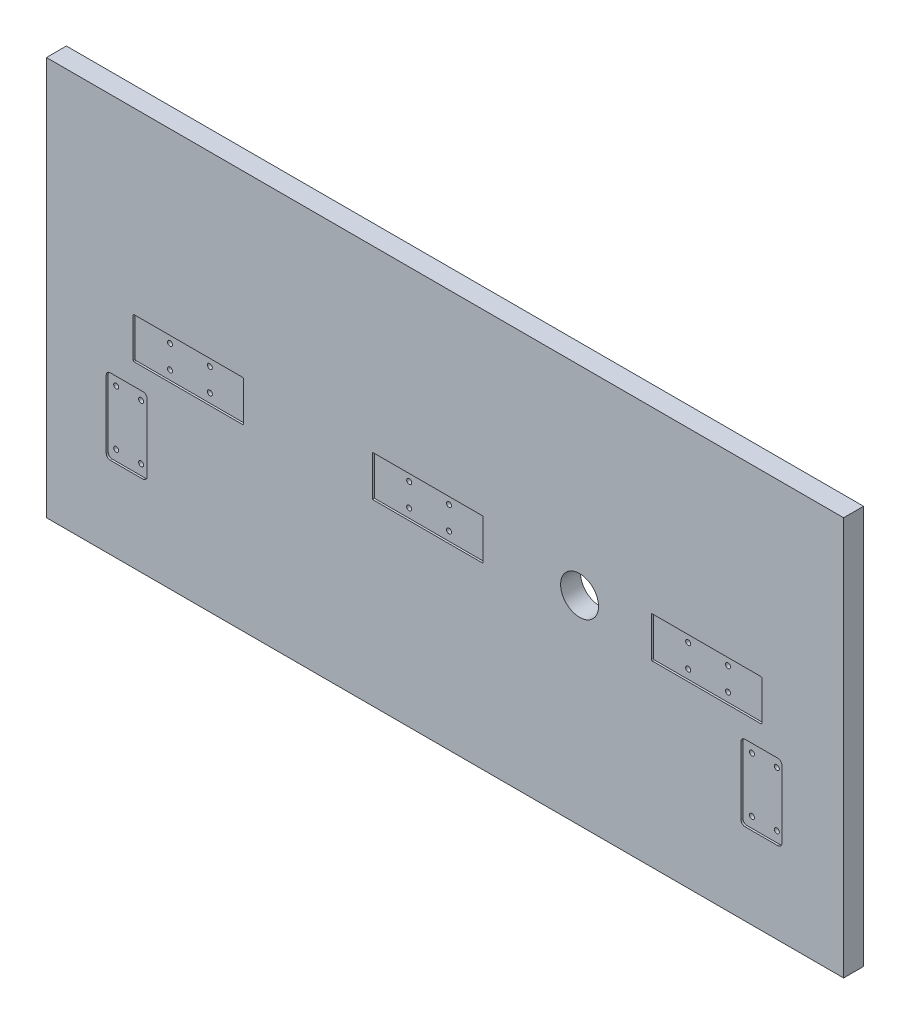
from build123d import *

# Parameters (mm, degrees)
SKETCH_1_W             = 800
SKETCH_1_H             = 400
EXTRUDE_1_DEPTH        = 20
SKETCH_2_W             = 111
SKETCH_2_H             = 41
CUT_EXTRUDE_1_DEPTH    = 2
HOLE_WIZARD_M6_2_D     = 5
HOLE_WIZARD_M6_2_DEPTH = 11
HOLE_WIZARD_M6_2_TIP   = 1.502151548
SKETCH_11_R            = 19.05
CUT_EXTRUDE_2_DEPTH    = 895.650769854
HOLE_WIZARD_M6_3_D     = 5
HOLE_WIZARD_M6_3_DEPTH = 13
HOLE_WIZARD_M6_3_TIP   = 1.502151548


with BuildPart() as part:
    # 스케치1 → 보스-돌출1 (new body)
    with BuildSketch(Plane.XY):
        with Locations((400, 200)):
            Rectangle(SKETCH_1_W, SKETCH_1_H)
    extrude(amount=EXTRUDE_1_DEPTH)

    # 스케치2 → 컷-돌출1 (cut)
    with BuildSketch(Plane.XY.offset(20)):
        with BuildLine():
            Line((64, 158), (97, 158))
            ThreePointArc((97, 158), (99.828427125, 156.828427125), (101, 154))
            Line((101, 154), (101, 86))
            ThreePointArc((101, 86), (99.828427125, 83.171572875), (97, 82))
            Line((97, 82), (64, 82))
            ThreePointArc((64, 82), (61.171572875, 83.171572875), (60, 86))
            Line((60, 86), (60, 154))
            ThreePointArc((60, 154), (61.171572875, 156.828427125), (64, 158))
        make_face()
        with BuildLine():
            Line((88, 220.5), (197, 220.5))
            ThreePointArc((197, 220.5), (197.707106781, 220.207106781), (198, 219.5))
            Line((198, 219.5), (198, 180.5))
            ThreePointArc((198, 180.5), (197.707106781, 179.792893219), (197, 179.5))
            Line((197, 179.5), (88, 179.5))
            ThreePointArc((88, 179.5), (87.292893219, 179.792893219), (87, 180.5))
            Line((87, 180.5), (87, 219.5))
            ThreePointArc((87, 219.5), (87.292893219, 220.207106781), (88, 220.5))
        make_face()
        with Locations((382.5, 200)):
            Rectangle(SKETCH_2_W, SKETCH_2_H)
        with BuildLine():
            Line((608, 220.5), (717, 220.5))
            ThreePointArc((717, 220.5), (717.707106781, 220.207106781), (718, 219.5))
            Line((718, 219.5), (718, 180.5))
            ThreePointArc((718, 180.5), (717.707106781, 179.792893219), (717, 179.5))
            Line((717, 179.5), (608, 179.5))
            ThreePointArc((608, 179.5), (607.292893219, 179.792893219), (607, 180.5))
            Line((607, 180.5), (607, 219.5))
            ThreePointArc((607, 219.5), (607.292893219, 220.207106781), (608, 220.5))
        make_face()
        with BuildLine():
            Line((701, 158), (734, 158))
            ThreePointArc((734, 158), (736.828427125, 156.828427125), (738, 154))
            Line((738, 154), (738, 86))
            ThreePointArc((738, 86), (736.828427125, 83.171572875), (734, 82))
            Line((734, 82), (701, 82))
            ThreePointArc((701, 82), (698.171572875, 83.171572875), (697, 86))
            Line((697, 86), (697, 154))
            ThreePointArc((697, 154), (698.171572875, 156.828427125), (701, 158))
        make_face()
    extrude(amount=-CUT_EXTRUDE_1_DEPTH, mode=Mode.SUBTRACT)

    # M6 나사 구멍2
    with Locations(Plane.XY.offset(18)):
        with Locations((162, 188.5), (162, 211.5), (122, 211.5), (122, 188.5), (93, 92.5), (68, 92.5), (68, 147.5), (93, 147.5), (362, 211.5), (402, 211.5), (402, 188.5), (362, 188.5), (642, 211.5), (682, 211.5), (682, 188.5), (642, 188.5), (706, 92.5), (731, 92.5), (731, 147.5), (706, 147.5)):
            Hole(HOLE_WIZARD_M6_2_D / 2, depth=HOLE_WIZARD_M6_2_DEPTH)
            with Locations((0, 0, -(HOLE_WIZARD_M6_2_DEPTH + HOLE_WIZARD_M6_2_TIP / 2))):  # 118° drill point
                Cone(0, HOLE_WIZARD_M6_2_D / 2, HOLE_WIZARD_M6_2_TIP, mode=Mode.SUBTRACT)

    # 스케치11 → 컷-돌출2 (cut, through all)
    with BuildSketch(Plane.XY.offset(20)):
        with Locations((535, 200)):
            Circle(SKETCH_11_R)
    extrude(amount=-CUT_EXTRUDE_2_DEPTH, mode=Mode.SUBTRACT)

    # M6 나사 구멍3
    with Locations(Plane(origin=(0, 0, 0), x_dir=(-1, 0, 0), z_dir=(0, 0, -1))):
        with Locations((-30, 10), (-70, 10), (-30, 50), (-70, 50), (-730, 10), (-770, 10), (-730, 50), (-770, 50), (-730, 390), (-770, 390), (-730, 350), (-770, 350), (-30, 390), (-70, 390), (-30, 350), (-70, 350)):
            Hole(HOLE_WIZARD_M6_3_D / 2, depth=HOLE_WIZARD_M6_3_DEPTH)
            with Locations((0, 0, -(HOLE_WIZARD_M6_3_DEPTH + HOLE_WIZARD_M6_3_TIP / 2))):  # 118° drill point
                Cone(0, HOLE_WIZARD_M6_3_D / 2, HOLE_WIZARD_M6_3_TIP, mode=Mode.SUBTRACT)


solid = part.part
